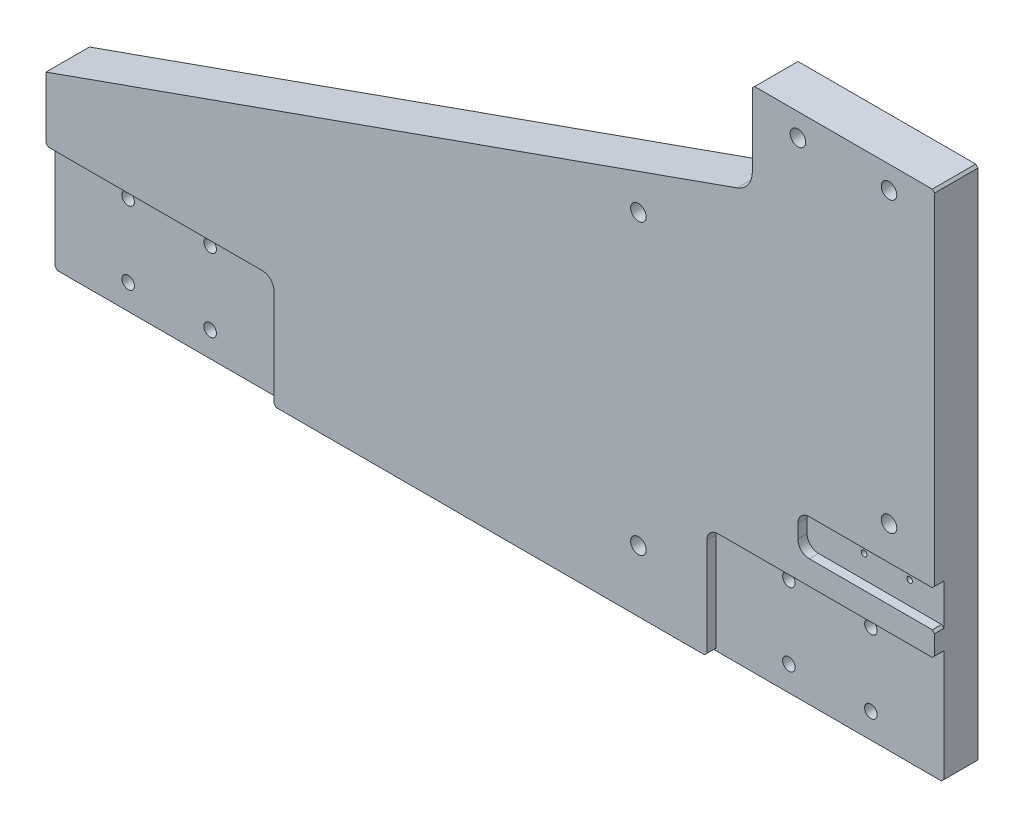
from build123d import *

# Parameters (mm, degrees)
BOSS_EXTRUDE1_DEPTH       = 19.05
CUT_EXTRUDE2_DEPTH        = 4.05
M5_CLEARANCE_HOLE1_D      = 5.5
M5_CLEARANCE_HOLE2_D      = 5.5
M3X0_5_TAPPED_HOLE1_D     = 2.5
M3X0_5_TAPPED_HOLE1_DEPTH = 7.5
M3X0_5_TAPPED_HOLE1_TIP   = 0.751075774
M8X1_25_TAPPED_HOLE1_D    = 6.8
FILLET1_R                 = 10
CHAMFER1_SIZE             = 1


with BuildPart() as part:
    # Sketch1 → Boss-Extrude1 (new body)
    with BuildSketch(Plane.XY):
        Polygon((-195, 50), (-195, -27), (195, -27), (195, 200), (115, 200), (115, 160), align=None)
    extrude(amount=BOSS_EXTRUDE1_DEPTH)

    # Sketch2 → Cut-Extrude2 (cut)
    with BuildSketch(Plane(origin=(0, 0, 0), x_dir=(-1, 0, 0), z_dir=(0, 0, -1))):
        with BuildLine():
            Line((-195, -27), (-95, -27))
            Line((-95, -27), (-95, 17))
            ThreePointArc((-95, 17), (-96.464466094, 20.535533906), (-100, 22))
            Line((-100, 22), (-195, 22))
            Line((-195, 22), (-195, -27))
        make_face()
        with BuildLine():
            Line((195, -27), (195, 22))
            Line((195, 22), (100, 22))
            ThreePointArc((100, 22), (96.464466094, 20.535533906), (95, 17))
            Line((95, 17), (95, -27))
            Line((95, -27), (195, -27))
        make_face()
        with BuildLine():
            Line((-195, 48.5), (-140, 48.5))
            ThreePointArc((-140, 48.5), (-136.464466094, 47.035533906), (-135, 43.5))
            Line((-135, 43.5), (-135, 37.5))
            ThreePointArc((-135, 37.5), (-136.464466094, 33.964466094), (-140, 32.5))
            Line((-140, 32.5), (-195, 32.5))
            Line((-195, 32.5), (-195, 48.5))
        make_face()
    extrude(amount=-CUT_EXTRUDE2_DEPTH, mode=Mode.SUBTRACT)

    # M5 Clearance Hole1 (through all)
    with Locations(Plane(origin=(0, 0, 4.05), x_dir=(-1, 0, 0), z_dir=(0, 0, -1))):
        with Locations((127, 16), (163, 16), (163, -16), (127, -16)):
            Hole(M5_CLEARANCE_HOLE1_D / 2)

    # M5 Clearance Hole2 (through all)
    with Locations(Plane(origin=(0, 0, 4.05), x_dir=(-1, 0, 0), z_dir=(0, 0, -1))):
        with Locations((-163, 16), (-127, 16), (-127, -16), (-163, -16)):
            Hole(M5_CLEARANCE_HOLE2_D / 2)

    # M3x0.5 Tapped Hole1
    with Locations(Plane(origin=(0, 0, 4.05), x_dir=(-1, 0, 0), z_dir=(0, 0, -1))):
        with Locations((-180, 42.5), (-160, 42.5)):
            Hole(M3X0_5_TAPPED_HOLE1_D / 2, depth=M3X0_5_TAPPED_HOLE1_DEPTH)
            with Locations((0, 0, -(M3X0_5_TAPPED_HOLE1_DEPTH + M3X0_5_TAPPED_HOLE1_TIP / 2))):  # 118° drill point
                Cone(0, M3X0_5_TAPPED_HOLE1_D / 2, M3X0_5_TAPPED_HOLE1_TIP, mode=Mode.SUBTRACT)

    # M8x1.25 Tapped Hole1 (through all)
    with Locations(Plane(origin=(0, 0, 0), x_dir=(-1, 0, 0), z_dir=(0, 0, -1))):
        with Locations((-175, 190), (-135, 190), (-65, 126.666666667), (-175, 63.333333333), (-65, 0)):
            Hole(M8X1_25_TAPPED_HOLE1_D / 2)

    # Fillet1
    fillet1_edges = [part.edges().sort_by_distance(p)[0] for p in [
        (115, 160, 9.525),
    ]]
    fillet(fillet1_edges, radius=FILLET1_R)

    # Chamfer1
    chamfer1_edges = [part.edges().sort_by_distance(p)[0] for p in [
        (115, 200, 9.525),
        (195, 200, 9.525),
        (195, -27, 11.55),
        (-195, -27, 11.55),
        (195, 48.5, 2.025),
        (195, 32.5, 2.025),
        (-95, -27, 2.025),
        (-195, 22, 2.025),
        (95, -27, 2.025),
        (195, 22, 2.025),
    ]]
    chamfer(chamfer1_edges, length=CHAMFER1_SIZE)


with BuildPart() as body_2:
    # Mirror1: mirrored copy
    add(part.part.mirror(Plane.XY))


solid = body_2.part
